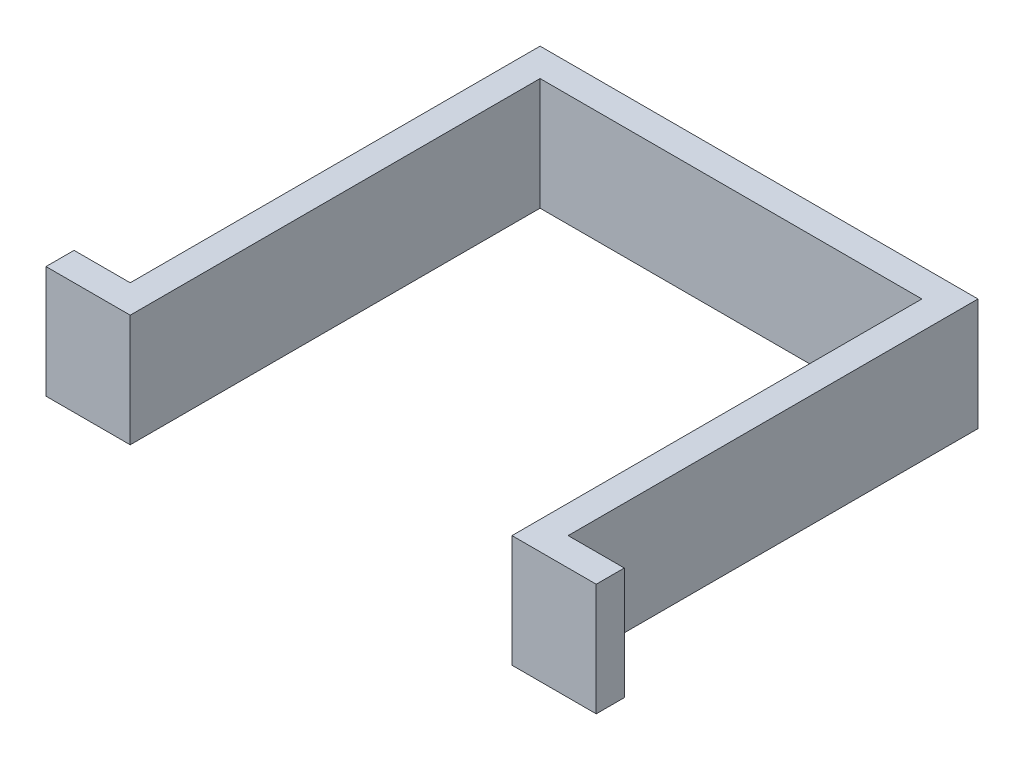
from build123d import *

# Parameters (mm, degrees)
BOSS_EXTRUDE1_DEPTH = 20


with BuildPart() as part:
    # Sketch1 → Boss-Extrude1 (new body)
    with BuildSketch(Plane(origin=(0, 0, 0), x_dir=(1, 0, 0), z_dir=(0, 1, 0))):
        Polygon((-49.464285714, 0), (-34.464285714, 0), (-34.464285714, 73), (33.535714286, 73), (33.535714286, 0), (48.535714286, 0), (48.535714286, 5), (38.535714286, 5), (38.535714286, 78), (-39.464285714, 78), (-39.464285714, 5), (-49.464285714, 5), align=None)
    extrude(amount=BOSS_EXTRUDE1_DEPTH)


solid = part.part
